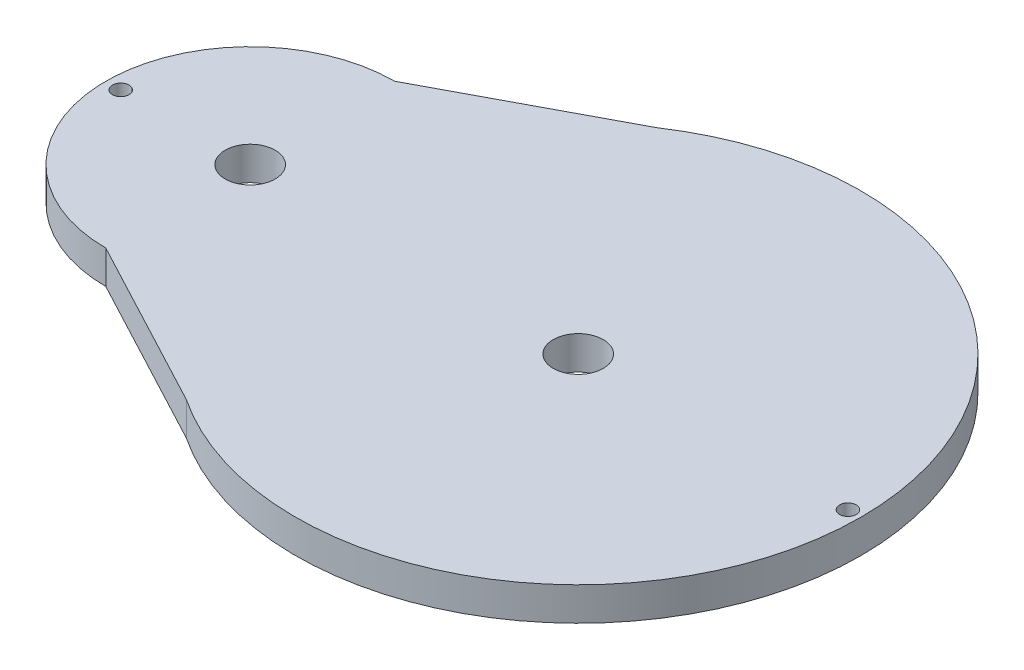
from build123d import *

# Parameters (mm, degrees)
SKETCH1_R           = 4.5
SKETCH1_R_2         = 44.53
BOSS_EXTRUDE1_DEPTH = 6
SKETCH2_R           = 1.5
CUT_EXTRUDE1_DEPTH  = 10


with BuildPart() as part:
    # Sketch1 → Boss-Extrude1 (new body)
    # profile 1 of 7: a face of its own
    with BuildSketch(Plane(origin=(0, 0, 0), x_dir=(1, 0, 0), z_dir=(0, 1, 0))):
        with BuildLine():
            Line((3.706249193, 49.435224426), (-27.146075319, 33.07485149))
            ThreePointArc((-27.146075319, 33.07485149), (-53.146075319, 7.07485149), (-27.146075319, -18.92514851))
            Line((-27.146075319, -18.92514851), (3.706249193, -35.285521446))
            ThreePointArc((3.706249193, -35.285521446), (-4.027102695, -28.958383674), (-10.375107984, -21.242151909))
            Line((-10.375107984, -21.242151909), (-27.146075319, -13.92514851))
            ThreePointArc((-27.146075319, -13.92514851), (-48.146075319, 7.07485149), (-27.146075319, 28.07485149))
            Line((-27.146075319, 28.07485149), (-9.910194417, 36.074047649))
            ThreePointArc((-9.910194417, 36.074047649), (-3.73365085, 43.398382562), (3.706249193, 49.435224426))
        make_face()
    # profile 2 of 7: a face of its own
    with BuildSketch(Plane(origin=(0, 0, 0), x_dir=(1, 0, 0), z_dir=(0, 1, 0))):
        with BuildLine():
            ThreePointArc((-10.375107984, -21.242151909), (-18.97940126, 7.487626122), (-9.910194417, 36.074047649))
            Line((-9.910194417, 36.074047649), (-27.146075319, 28.07485149))
            ThreePointArc((-27.146075319, 28.07485149), (-48.146075319, 7.07485149), (-27.146075319, -13.92514851))
            Line((-27.146075319, -13.92514851), (-10.375107984, -21.242151909))
        make_face()
        with Locations(Location((-27.146075319, 7.07485149, 0), (0, 0, 270))):
            Circle(SKETCH1_R, mode=Mode.SUBTRACT)
    # profile 3 of 7: a face of its own
    with BuildSketch(Plane(origin=(0, 0, 0), x_dir=(1, 0, 0), z_dir=(0, 1, 0))):
        with BuildLine():
            ThreePointArc((82.798924681, 7.07485149), (55.935555161, 51.935893919), (3.706249193, 49.435224426))
            ThreePointArc((3.706249193, 49.435224426), (-3.73365085, 43.398382562), (-9.910194417, 36.074047649))
            Line((-9.910194417, 36.074047649), (6.70287652, 43.784196842))
            ThreePointArc((6.70287652, 43.784196842), (52.651339866, 46.478824796), (76.438924681, 7.07485149))
            ThreePointArc((76.438924681, 7.07485149), (50.975331795, -33.166831126), (3.706249193, -27.385705604))
            Line((3.706249193, -27.385705604), (-10.375107984, -21.242151909))
            ThreePointArc((-10.375107984, -21.242151909), (-4.027102695, -28.958383674), (3.706249193, -35.285521446))
            ThreePointArc((3.706249193, -35.285521446), (55.935555161, -37.786190939), (82.798924681, 7.07485149))
        make_face()
    # profile 4 of 7: a face of its own
    with BuildSketch(Plane(origin=(0, 0, 0), x_dir=(1, 0, 0), z_dir=(0, 1, 0))):
        with BuildLine():
            Line((6.70287652, 43.784196842), (-9.910194417, 36.074047649))
            ThreePointArc((-9.910194417, 36.074047649), (-18.97940126, 7.487626122), (-10.375107984, -21.242151909))
            Line((-10.375107984, -21.242151909), (3.706249193, -27.385705604))
            ThreePointArc((3.706249193, -27.385705604), (-12.581655153, 8.948138973), (6.70287652, 43.784196842))
        make_face()
    # profile 5 of 7: a face of its own
    with BuildSketch(Plane(origin=(0, 0, 0), x_dir=(1, 0, 0), z_dir=(0, 1, 0))):
        with BuildLine():
            ThreePointArc((82.798924681, 7.07485149), (55.935555161, 51.935893919), (3.706249193, 49.435224426))
            ThreePointArc((3.706249193, 49.435224426), (-3.73365085, 43.398382562), (-9.910194417, 36.074047649))
            Line((-9.910194417, 36.074047649), (6.70287652, 43.784196842))
            ThreePointArc((6.70287652, 43.784196842), (52.651339866, 46.478824796), (76.438924681, 7.07485149))
            ThreePointArc((76.438924681, 7.07485149), (50.975331795, -33.166831126), (3.706249193, -27.385705604))
            Line((3.706249193, -27.385705604), (-10.375107984, -21.242151909))
            ThreePointArc((-10.375107984, -21.242151909), (-4.027102695, -28.958383674), (3.706249193, -35.285521446))
            ThreePointArc((3.706249193, -35.285521446), (55.935555161, -37.786190939), (82.798924681, 7.07485149))
        make_face()
    # profile 6 of 7: a face of its own
    with BuildSketch(Plane(origin=(0, 0, 0), x_dir=(1, 0, 0), z_dir=(0, 1, 0))):
        with BuildLine():
            Line((6.70287652, 43.784196842), (-9.910194417, 36.074047649))
            ThreePointArc((-9.910194417, 36.074047649), (-18.97940126, 7.487626122), (-10.375107984, -21.242151909))
            Line((-10.375107984, -21.242151909), (3.706249193, -27.385705604))
            ThreePointArc((3.706249193, -27.385705604), (-12.581655153, 8.948138973), (6.70287652, 43.784196842))
        make_face()
    # profile 7 of 7: a face of its own
    with BuildSketch(Plane(origin=(0, 0, 0), x_dir=(1, 0, 0), z_dir=(0, 1, 0))):
        with Locations((31.908924681, 7.07485149)):
            Circle(SKETCH1_R_2)
        with Locations(Location((31.908924681, 7.07485149, 0), (0, 0, 270))):
            Circle(SKETCH1_R, mode=Mode.SUBTRACT)
    extrude(amount=BOSS_EXTRUDE1_DEPTH)

    # Sketch2 → Cut-Extrude1 (cut)
    with BuildSketch(Plane(origin=(0, 6, 0), x_dir=(1, 0, 0), z_dir=(0, 1, 0))):
        with Locations(Location((-50.446075319, 7.07485149, 0), (0, 0, 270))):
            Circle(SKETCH2_R)
        with Locations(Location((80.458924681, 7.07485149, 0), (0, 0, 270))):
            Circle(SKETCH2_R)
    extrude(amount=-CUT_EXTRUDE1_DEPTH, mode=Mode.SUBTRACT)


solid = part.part
